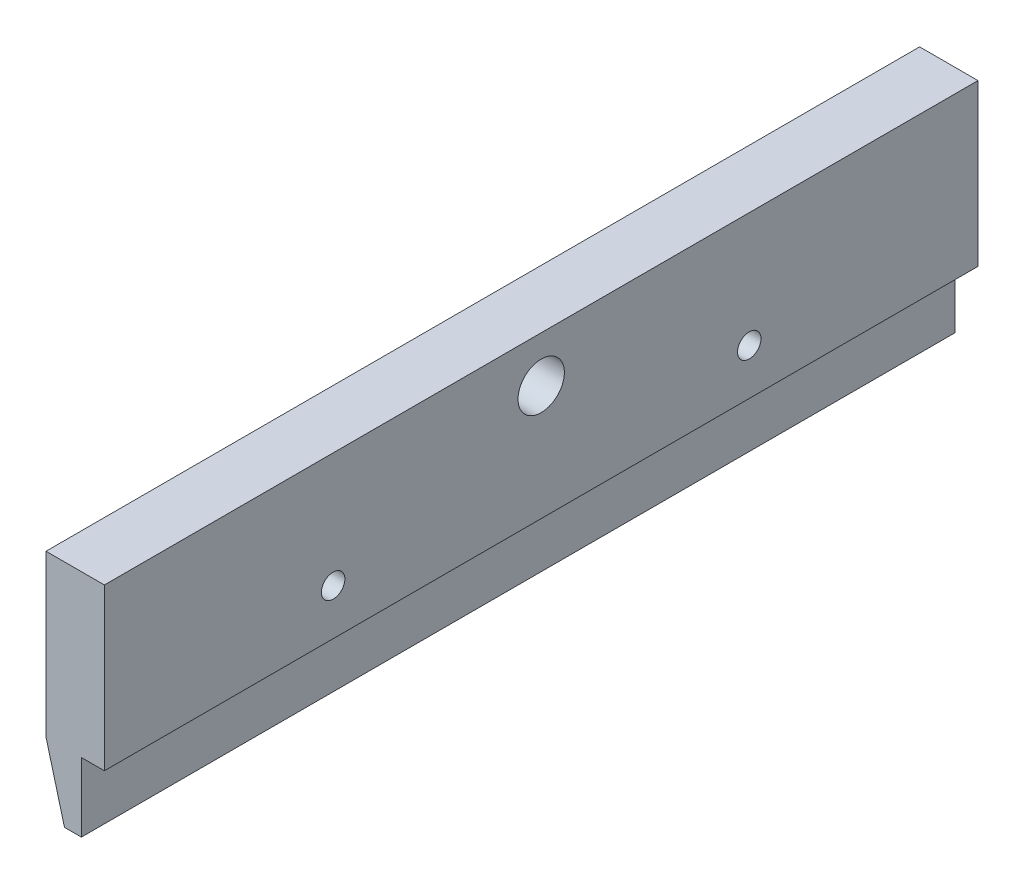
from build123d import *

# Parameters (mm, degrees)
SALIENTE_EXTRUIR1_DEPTH       = 95
TALADRO_ROSCADO_1_4_201_D     = 5.1054
TALADRO_DE_MARGEN_PARA_3_81_D = 10.0838


with BuildPart() as part:
    # Croquis1 → Saliente-Extruir1 (new, symmetric)
    with BuildSketch(Plane.XY):
        Polygon((6.35, -17.5), (1.35, -17.5), (1.35, -32.5), (-2.330762114, -32.5), (-6.35, -17.5), (-6.35, 17.5), (6.35, 17.5), align=None)
    extrude(amount=SALIENTE_EXTRUIR1_DEPTH, both=True)

    # Taladro roscado 1/4-201 (through all)
    with Locations(Plane(origin=(6.35, 0, 0), x_dir=(0, 0, -1), z_dir=(1, 0, 0))):
        with Locations((45.25, -7.5), (-45.25, -7.5)):
            Hole(TALADRO_ROSCADO_1_4_201_D / 2)

    # Taladro de margen para 3/81 (through all)
    with Locations(Plane(origin=(6.35, 0, 0), x_dir=(0, 0, -1), z_dir=(1, 0, 0))):
        with Locations((0, 7.5)):
            Hole(TALADRO_DE_MARGEN_PARA_3_81_D / 2)


solid = part.part
